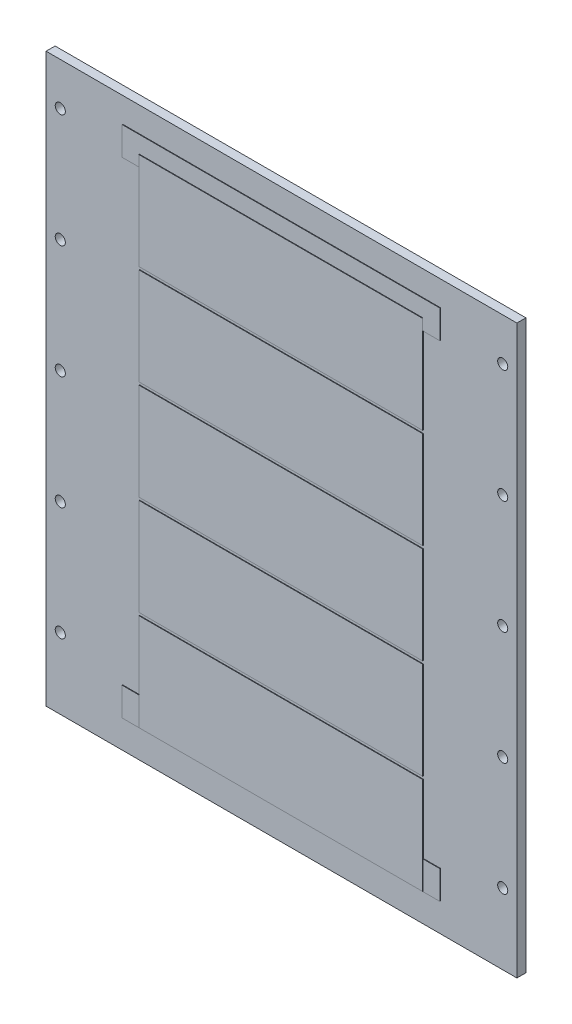
from build123d import *

# Parameters (mm, degrees)
SKETCH1_W                 = 83
SKETCH1_H                 = 100
BOSS_EXTRUDE1_DEPTH       = 1.5875
F_0_CLEARANCE_HOLE1_D     = 1.778
F_0_CLEARANCE_HOLE1_DEPTH = 3.175
F_0_CLEARANCE_HOLE1_TIP   = 0.53416509
SKETCH5_W                 = 50
SKETCH5_H                 = 17.1
BOSS_EXTRUDE3_DEPTH       = 0.1
BOSS_EXTRUDE4_DEPTH       = 0.1
SKETCH7_W                 = 2.99
SKETCH7_H                 = 5
BOSS_EXTRUDE5_DEPTH       = 0.1


with BuildPart() as part:
    # Sketch1 → Boss-Extrude1 (new body)
    with BuildSketch(Plane.XY):
        Rectangle(SKETCH1_W, SKETCH1_H)
    extrude(amount=BOSS_EXTRUDE1_DEPTH)

    # #0 Clearance Hole1
    with Locations(Plane.XY.offset(1.5875)):
        with Locations((-39, 42.5), (-39, 22.5), (-39, 2.5), (-39, -17.5), (-39, -37.5), (39, -37.5), (39, -17.5), (39, 2.5), (39, 22.5), (39, 42.5)):
            Hole(F_0_CLEARANCE_HOLE1_D / 2, depth=F_0_CLEARANCE_HOLE1_DEPTH)
            with Locations((0, 0, -(F_0_CLEARANCE_HOLE1_DEPTH + F_0_CLEARANCE_HOLE1_TIP / 2))):  # 118° drill point
                Cone(0, F_0_CLEARANCE_HOLE1_D / 2, F_0_CLEARANCE_HOLE1_TIP, mode=Mode.SUBTRACT)

    # Sketch5 → Boss-Extrude3 (add)
    with BuildSketch(Plane.XY.offset(1.5875)):
        with Locations((0, 16.35)):
            Rectangle(SKETCH5_W, SKETCH5_H)
        with Locations((0, 33.95)):
            Rectangle(SKETCH5_W, SKETCH5_H)
        with Locations((0, -1.25)):
            Rectangle(SKETCH5_W, SKETCH5_H)
        with Locations((0, -18.85)):
            Rectangle(SKETCH5_W, SKETCH5_H)
        with Locations((0, -36.45)):
            Rectangle(SKETCH5_W, SKETCH5_H)
    extrude(amount=BOSS_EXTRUDE3_DEPTH)

    # Sketch7 → Boss-Extrude5 (add)
    with BuildSketch(Plane.XY.offset(1.5875)):
        with Locations((26.505, -42.5)):
            Rectangle(SKETCH7_W, SKETCH7_H)
        with Locations((-26.505, -42.5)):
            Rectangle(SKETCH7_W, SKETCH7_H)
    extrude(amount=BOSS_EXTRUDE5_DEPTH)


with BuildPart() as body_2:
    # Sketch6 → Boss-Extrude4 (new body)
    with BuildSketch(Plane.XY.offset(1.5875)):
        Polygon((-25, 42.6), (25, 42.6), (25, 40.6), (28, 40.6), (28, 42.6), (28, 45.6), (-28, 45.6), (-28, 42.6), (-28, 40.6), (-25, 40.6), align=None)
    extrude(amount=BOSS_EXTRUDE4_DEPTH)


solid = Compound([part.part, body_2.part])
